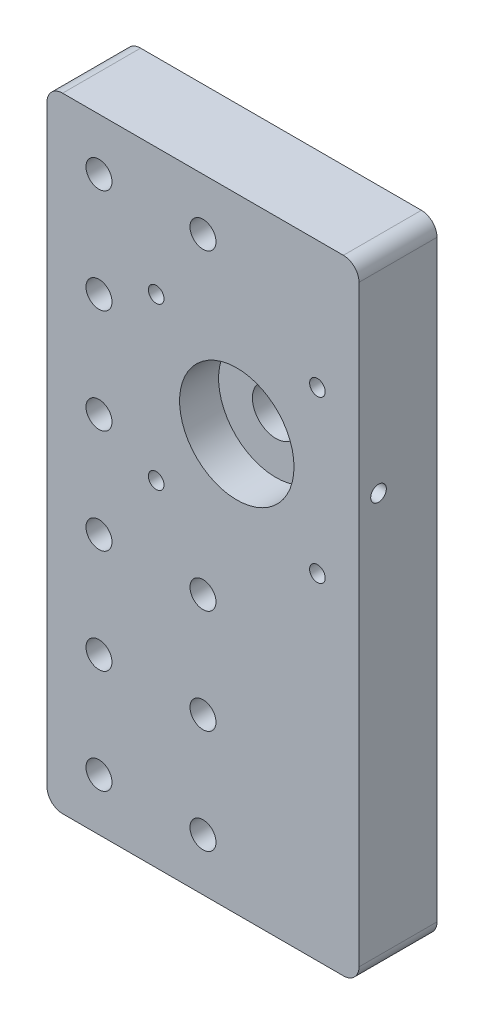
from build123d import *

# Parameters (mm, degrees)
SKETCH1_W           = 60
SKETCH1_H           = 120
SKETCH1_R           = 2.5
BOSS_EXTRUDE1_DEPTH = 15
FILLET1_R           = 3
SKETCH2_R           = 1.5
SKETCH2_R_2         = 4.5
CUT_EXTRUDE1_DEPTH  = 136
SKETCH2_3_R         = 11
SKETCH2_3_R_2       = 4.5
CUT_EXTRUDE2_DEPTH  = 7.5
CUT_EXTRUDE3_REACH  = 137
SKETCH3_R           = 1.5


with BuildPart() as part:
    # Sketch1 → Boss-Extrude1 (new body)
    with BuildSketch(Plane.XY):
        with Locations((30, 60)):
            Rectangle(SKETCH1_W, SKETCH1_H)
        with Locations((10, 110)):
            Circle(SKETCH1_R, mode=Mode.SUBTRACT)
        with Locations((30, 110)):
            Circle(SKETCH1_R, mode=Mode.SUBTRACT)
        with Locations((10, 90)):
            Circle(SKETCH1_R, mode=Mode.SUBTRACT)
        with Locations((10, 70)):
            Circle(SKETCH1_R, mode=Mode.SUBTRACT)
        with Locations((10, 10)):
            Circle(SKETCH1_R, mode=Mode.SUBTRACT)
        with Locations((30, 10)):
            Circle(SKETCH1_R, mode=Mode.SUBTRACT)
        with Locations((30, 50)):
            Circle(SKETCH1_R, mode=Mode.SUBTRACT)
        with Locations((10, 50)):
            Circle(SKETCH1_R, mode=Mode.SUBTRACT)
        with Locations((10, 30)):
            Circle(SKETCH1_R, mode=Mode.SUBTRACT)
        with Locations((30, 30)):
            Circle(SKETCH1_R, mode=Mode.SUBTRACT)
    extrude(amount=BOSS_EXTRUDE1_DEPTH)

    # Fillet1
    fillet1_edges = [part.edges().sort_by_distance(p)[0] for p in [
        (0, 0, 7.5),
        (60, 0, 7.5),
        (0, 120, 7.5),
        (60, 120, 7.5),
    ]]
    fillet(fillet1_edges, radius=FILLET1_R)

    # Sketch2 → Cut-Extrude1 (cut, through all)
    with BuildSketch(Plane.XY.offset(15)):
        with Locations((21, 95.5)):
            Circle(SKETCH2_R)
        with Locations((52, 95.5)):
            Circle(SKETCH2_R)
        with Locations((52, 64.5)):
            Circle(SKETCH2_R)
        with Locations((21, 64.5)):
            Circle(SKETCH2_R)
        with Locations((36.5, 80)):
            Circle(SKETCH2_R_2)
    extrude(amount=-CUT_EXTRUDE1_DEPTH, mode=Mode.SUBTRACT)

    # Sketch2<3> → Cut-Extrude2 (cut)
    with BuildSketch(Plane.XY.offset(15)):
        with Locations((36.5, 80)):
            Circle(SKETCH2_3_R)
        with Locations((36.5, 80)):
            Circle(SKETCH2_3_R_2, mode=Mode.SUBTRACT)
    extrude(amount=-CUT_EXTRUDE2_DEPTH, mode=Mode.SUBTRACT)

    # Sketch3 → Cut-Extrude3 (cut, up to next)
    with BuildSketch(Plane(origin=(60, 0, 0), x_dir=(0, 0, -1), z_dir=(1, 0, 0)), mode=Mode.PRIVATE) as cut_extrude3_sk1:
        with Locations((-11.25, 80)):
            Circle(SKETCH3_R)
    cut_extrude3_tool1 = extrude(cut_extrude3_sk1.sketch, amount=-CUT_EXTRUDE3_REACH, mode=Mode.PRIVATE) & part.part
    add(cut_extrude3_tool1.solids().sort_by_distance((60, 80, 11.25))[0], mode=Mode.SUBTRACT)


solid = part.part
